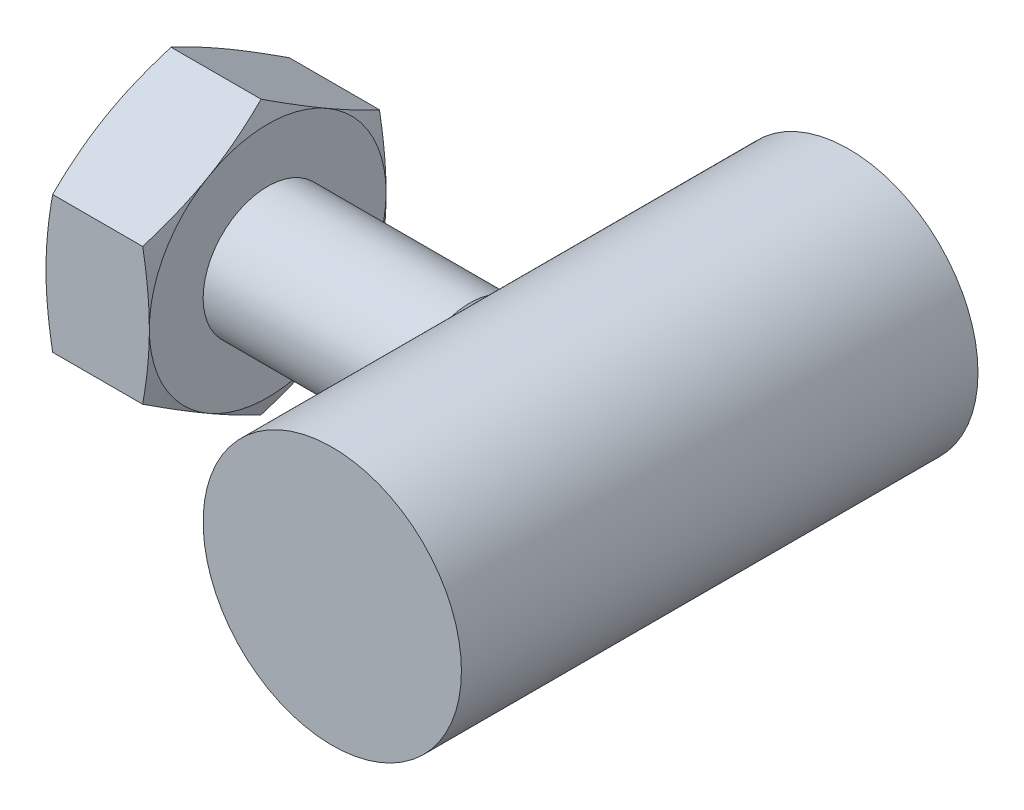
from build123d import *

# Parameters (mm, degrees)
SKETCH1_W          = 12
SKETCH1_H          = 3
SKETCH4_W          = 11
SKETCH4_H          = 11
CUT_EXTRUDE1_DEPTH = 2.4


with BuildPart() as part:
    # Sketch1 → Revolve1 (revolve)
    with BuildSketch(Plane(origin=(0, 0, 0), x_dir=(0, 0, -1), z_dir=(1, 0, 0)), mode=Mode.PRIVATE) as revolve1_sk:
        with Locations((0, 1.5)):
            Rectangle(SKETCH1_W, SKETCH1_H)
    revolve(revolve1_sk.sketch.rotate(Axis((0, 0, -6), (0, 0, 1)), 270), axis=Axis((0, 0, -6), (0, 0, 1)))

    # Sketch2 → Revolve2 (revolve)
    with BuildSketch(Plane.XY, mode=Mode.PRIVATE) as revolve2_sk:
        Polygon((-10, 0), (-10, 1.1935), (-9.6935, 1.5), (-2.8065, 1.5), (-2.5, 1.1935), (-2.5, 0), align=None)
    revolve(revolve2_sk.sketch.rotate(Axis((-2.5, 0, 0), (-1, 0, 0)), 270), axis=Axis((-2.5, 0, 0), (-1, 0, 0)))

    # Sketch3 → Revolve3 (revolve)
    with BuildSketch(Plane.XY, mode=Mode.PRIVATE) as revolve3_sk:
        Polygon((-9.9, 2.75), (-9.9, 1.5), (-7.5, 1.5), (-7.5, 2.75), (-7.654842576, 3.175426481), (-9.745157424, 3.175426481), align=None)
    revolve(revolve3_sk.sketch.rotate(Axis((42.5, 0, 0), (-1, 0, 0)), 270), axis=Axis((42.5, 0, 0), (-1, 0, 0)))

    # Sketch4 → Cut-Extrude1 (cut)
    with BuildSketch(Plane(origin=(-7.5, 0, 0), x_dir=(0, 0, -1), z_dir=(1, 0, 0))):
        Rectangle(SKETCH4_W, SKETCH4_H)
        Polygon((-2.75, -1.58771324), (0, -3.175426481), (2.75, -1.58771324), (2.75, 1.58771324), (0, 3.175426481), (-2.75, 1.58771324), align=None, mode=Mode.SUBTRACT)
    extrude(amount=-CUT_EXTRUDE1_DEPTH, mode=Mode.SUBTRACT)


solid = part.part
